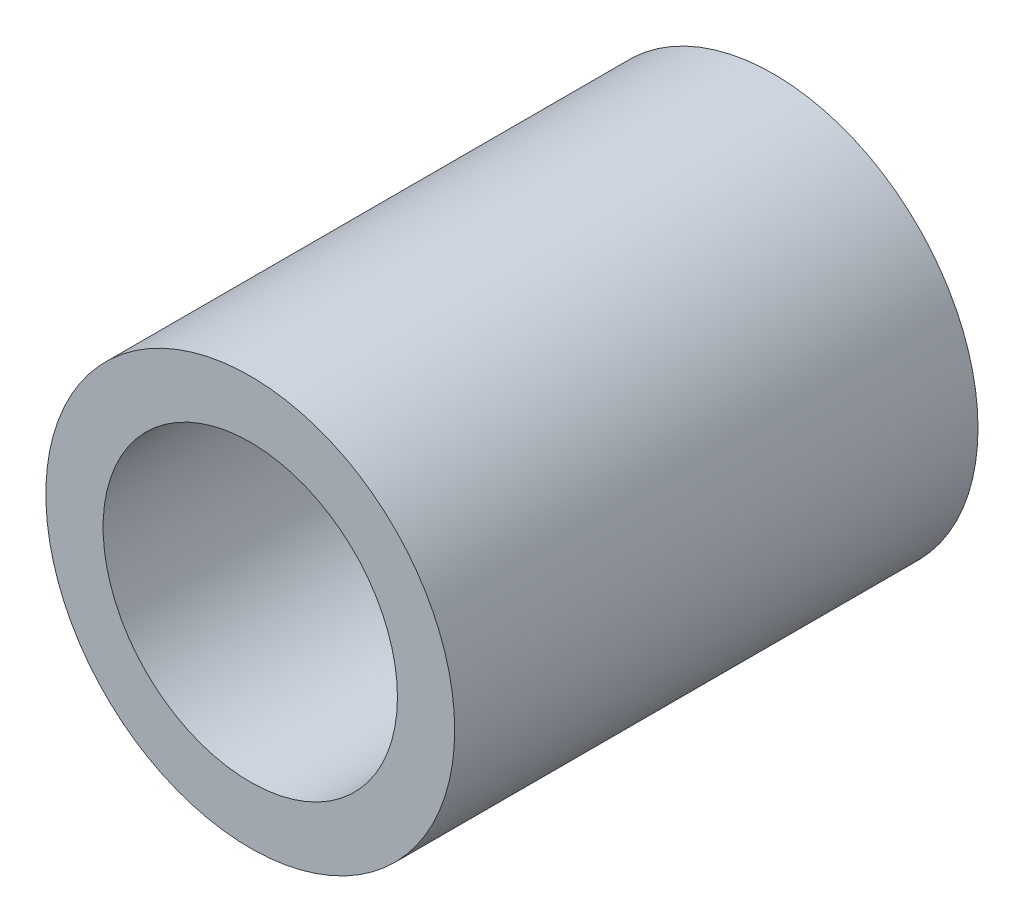
from build123d import *

# Parameters (mm, degrees)
SKETCH1_R           = 12.5
SKETCH1_R_2         = 9
BOSS_EXTRUDE1_DEPTH = 16


with BuildPart() as part:
    # Sketch1 → Boss-Extrude1 (new, symmetric)
    with BuildSketch(Plane.XY):
        Circle(SKETCH1_R)
        Circle(SKETCH1_R_2, mode=Mode.SUBTRACT)
    extrude(amount=BOSS_EXTRUDE1_DEPTH, both=True)


solid = part.part
